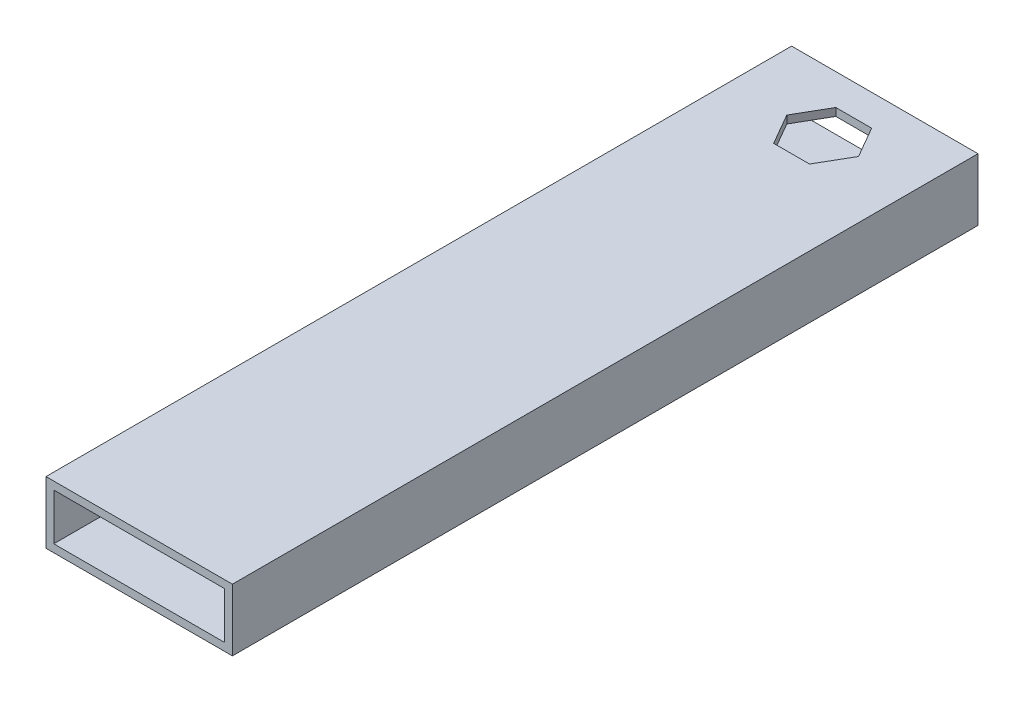
from build123d import *

# Parameters (mm, degrees)
SKETCH1_W           = 38.1
SKETCH1_H           = 12.7
BOSS_EXTRUDE1_DEPTH = 152.4
SKETCH2_W           = 34.925
SKETCH2_H           = 9.525
CUT_EXTRUDE1_DEPTH  = 158.602855304
CUT_EXTRUDE2_DEPTH  = 158.602855304


with BuildPart() as part:
    # Sketch1 → Boss-Extrude1 (new body)
    with BuildSketch(Plane.XY):
        with Locations((19.05, 6.35)):
            Rectangle(SKETCH1_W, SKETCH1_H)
    extrude(amount=BOSS_EXTRUDE1_DEPTH)

    # Sketch2 → Cut-Extrude1 (cut, through all)
    with BuildSketch(Plane.XY.offset(152.4)):
        with Locations((19.05, 6.35)):
            Rectangle(SKETCH2_W, SKETCH2_H)
    extrude(amount=-CUT_EXTRUDE1_DEPTH, mode=Mode.SUBTRACT)

    # Sketch3 → Cut-Extrude2 (cut, through all)
    with BuildSketch(Plane.XZ):
        Polygon((26.382348419, 12.7), (22.716174209, 19.05), (15.383825791, 19.05), (11.717651581, 12.7), (15.383825791, 6.35), (22.716174209, 6.35), align=None)
    extrude(amount=-CUT_EXTRUDE2_DEPTH, mode=Mode.SUBTRACT)


solid = part.part
